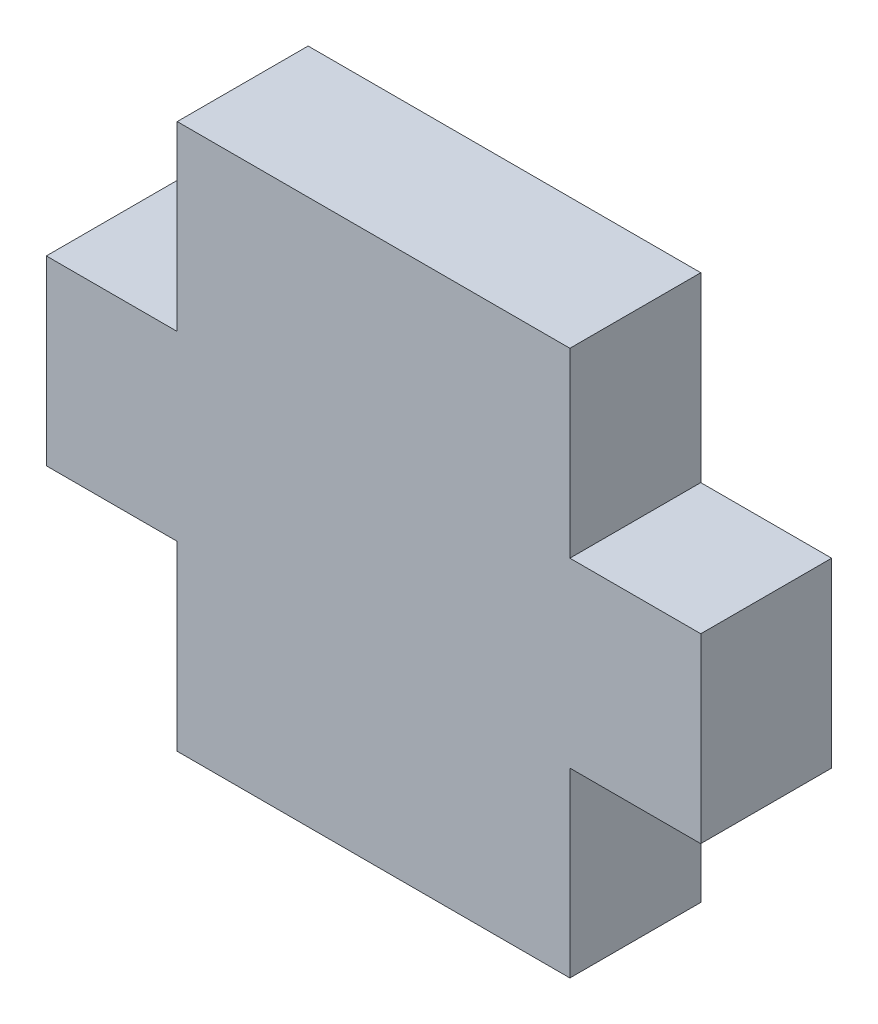
from build123d import *

# Parameters (mm, degrees)
SKETCH1_W           = 76.2
SKETCH1_H           = 63.5
BOSS_EXTRUDE1_DEPTH = 15.24
SKETCH2_W           = 15.24
SKETCH2_H           = 21.166666667
CUT_EXTRUDE1_DEPTH  = 15.24


with BuildPart() as part:
    # Sketch1 → Boss-Extrude1 (new body)
    with BuildSketch(Plane.XY):
        with Locations((38.1, 31.75)):
            Rectangle(SKETCH1_W, SKETCH1_H)
    extrude(amount=BOSS_EXTRUDE1_DEPTH)

    # Sketch2 → Cut-Extrude1 (cut)
    with BuildSketch(Plane.XY.offset(15.24)):
        with Locations((7.62, 52.916666667)):
            Rectangle(SKETCH2_W, SKETCH2_H)
        with Locations((7.62, 10.583333334)):
            Rectangle(SKETCH2_W, SKETCH2_H)
        with Locations((68.58, 52.916666667)):
            Rectangle(SKETCH2_W, SKETCH2_H)
        with Locations((68.58, 10.583333334)):
            Rectangle(SKETCH2_W, SKETCH2_H)
    extrude(amount=-CUT_EXTRUDE1_DEPTH, mode=Mode.SUBTRACT)


solid = part.part
